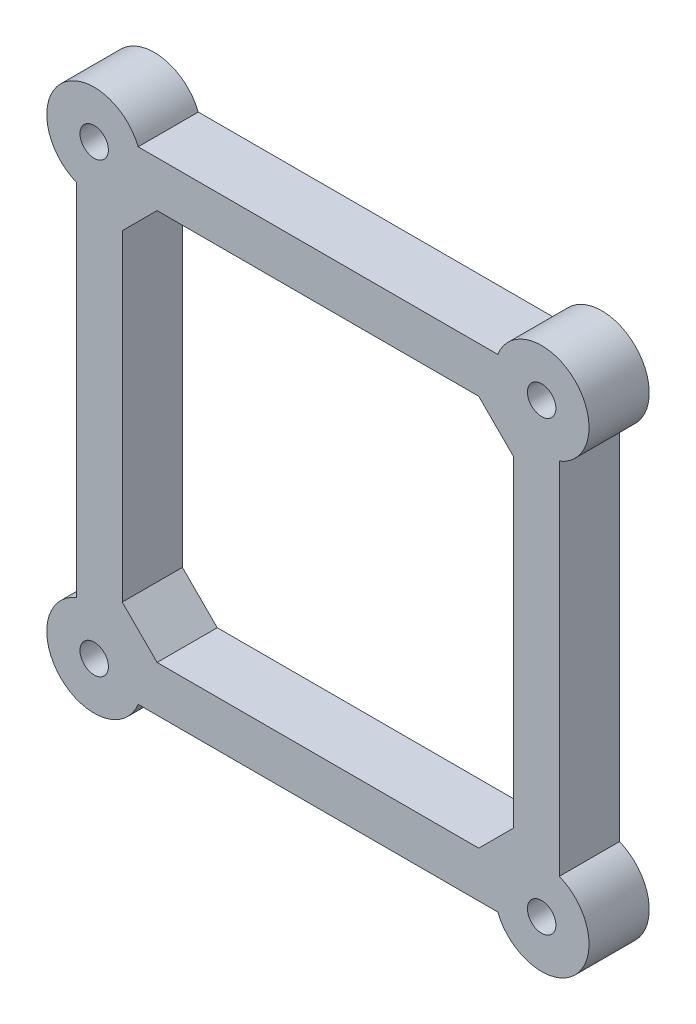
from build123d import *

# Parameters (mm, degrees)
BOSS_EXTRU_2_DEPTH        = 6.35
ESQUISSE29_R              = 5
BOSS_EXTRU_3_DEPTH        = 6.35
SYM_TRIE2_COPY_1_SKETCH_R = 5
SYM_TRIE2_COPY_1_DEPTH    = 6.35
ESQUISSE30_R              = 1.5
ENL_V_MAT_EXTRU_1_DEPTH   = 41.953581056


with BuildPart() as part:
    # Esquisse28 → Boss.-Extru.2 (new body)
    with BuildSketch(Plane.XY):
        Polygon((-18.97, -25.475382387), (-25.475382387, -18.97), (-25.475382387, 18.97), (-18.97, 25.475382387), (18.97, 25.475382387), (25.475382387, 18.97), (25.475382387, -18.97), (18.97, -25.475382387), align=None)
        Polygon((-16.97, -20.645541049), (-20.645541049, -16.97), (-20.645541049, 16.97), (-16.97, 20.645541049), (16.97, 20.645541049), (20.645541049, 16.97), (20.645541049, -16.97), (16.97, -20.645541049), align=None, mode=Mode.SUBTRACT)
    extrude(amount=BOSS_EXTRU_2_DEPTH)

    # Esquisse29 → Boss.-Extru.3 (add)
    with BuildSketch(Plane.XY):
        with Locations((23.60833184, 23.60833184)):
            Circle(ESQUISSE29_R)
    boss_extru_3 = extrude(amount=BOSS_EXTRU_3_DEPTH)

    # Symétrie1: Boss.-Extru.3 across plane
    add(boss_extru_3.mirror(Plane(origin=(0, 0, 0), x_dir=(0, 0, 1), z_dir=(1, 0, 0))))

    # Symétrie2: Boss.-Extru.3 across plane
    add(boss_extru_3.mirror(Plane.ZX))

    # Symétrie2 copy 1 sketch → Symétrie2 copy 1 (add)
    with BuildSketch(Plane(origin=(0, 0, 0), x_dir=(-1, 0, 0), z_dir=(0, 0, 1))):
        with Locations((23.60833184, 23.60833184)):
            Circle(SYM_TRIE2_COPY_1_SKETCH_R)
    extrude(amount=SYM_TRIE2_COPY_1_DEPTH)

    # Esquisse30 → Enlèv. mat.-Extru.1 (cut, through all)
    with BuildSketch(Plane.XY.offset(6.35)):
        with Locations((-23.60833184, 23.60833184)):
            Circle(ESQUISSE30_R)
        with Locations((23.60833184, 23.60833184)):
            Circle(ESQUISSE30_R)
        with Locations((23.60833184, -23.60833184)):
            Circle(ESQUISSE30_R)
        with Locations((-23.60833184, -23.60833184)):
            Circle(ESQUISSE30_R)
    extrude(amount=-ENL_V_MAT_EXTRU_1_DEPTH, mode=Mode.SUBTRACT)


solid = part.part
